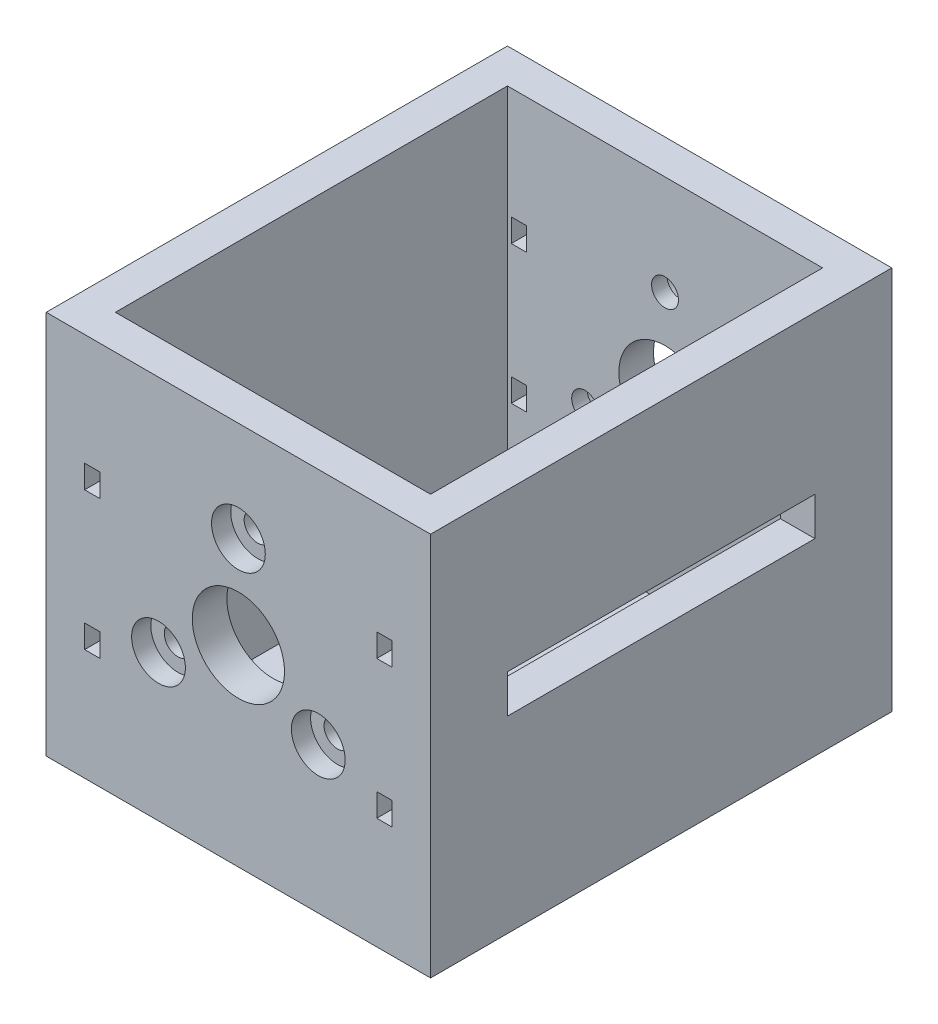
from build123d import *

# Parameters (mm, degrees)
SKETCH1_W                                  = 50
SKETCH1_H                                  = 50
BOSS_EXTRUDE1_DEPTH                        = 30
SKETCH3_R                                  = 6
CUT_EXTRUDE1_DEPTH                         = 70
SKETCH5_W                                  = 41
SKETCH5_H                                  = 51
CUT_EXTRUDE3_DEPTH                         = 48
SKETCH7_R                                  = 1.75
CUT_EXTRUDE5_DEPTH                         = 60
CIRPATTERN3_COUNT                          = 3
SKETCH8_W                                  = 2
SKETCH8_H                                  = 3
CUT_EXTRUDE6_DEPTH                         = 60
MIRROR1_AT_THE_SECOND_PLANE_COPY_1_SKETC_W = 2
MIRROR1_AT_THE_SECOND_PLANE_COPY_1_SKETC_H = 3
MIRROR1_AT_THE_SECOND_PLANE_COPY_1_DEPTH   = 60
SKETCH9_W                                  = 40
SKETCH9_H                                  = 5
CUT_EXTRUDE7_DEPTH                         = 40
SKETCH10_R                                 = 3.5
CUT_EXTRUDE8_DEPTH                         = 2.5
CIRPATTERN4_COUNT                          = 3
MIRROR2_COPY_1_SKETCH_R                    = 3.5
MIRROR2_COPY_1_DEPTH                       = 2.5
MIRROR2_COPY_2_SKETCH_R                    = 3.5
MIRROR2_COPY_2_DEPTH                       = 2.5


with BuildPart() as part:
    # Sketch1 → Boss-Extrude1 (new, symmetric)
    with BuildSketch(Plane.XY):
        Rectangle(SKETCH1_W, SKETCH1_H)
    extrude(amount=BOSS_EXTRUDE1_DEPTH, both=True)

    # Sketch3 → Cut-Extrude1 (cut)
    with BuildSketch(Plane.XY.offset(30)):
        Circle(SKETCH3_R)
    extrude(amount=-CUT_EXTRUDE1_DEPTH, mode=Mode.SUBTRACT)

    # Sketch5 → Cut-Extrude3 (cut)
    with BuildSketch(Plane(origin=(0, 25, 0), x_dir=(1, 0, 0), z_dir=(0, 1, 0))):
        Rectangle(SKETCH5_W, SKETCH5_H)
    extrude(amount=-CUT_EXTRUDE3_DEPTH, mode=Mode.SUBTRACT)

    # Sketch7 → Cut-Extrude5 (cut)
    with BuildSketch(Plane.XY.offset(30)):
        with Locations((0, 12)):
            Circle(SKETCH7_R)
    cut_extrude5 = extrude(amount=-CUT_EXTRUDE5_DEPTH, mode=Mode.SUBTRACT)

    # CirPattern3: Cut-Extrude5 ×3 about axis
    cirpattern3_axis = Axis((0, 0, 0), (0, 0, 1))
    for i in range(1, CIRPATTERN3_COUNT):
        add(cut_extrude5.rotate(cirpattern3_axis, i * 360 / CIRPATTERN3_COUNT), mode=Mode.SUBTRACT)

    # Sketch8 → Cut-Extrude6 (cut)
    with BuildSketch(Plane.XY.offset(30)):
        with Locations((19, 9)):
            Rectangle(SKETCH8_W, SKETCH8_H)
    cut_extrude6 = extrude(amount=-CUT_EXTRUDE6_DEPTH, mode=Mode.SUBTRACT)

    # Mirror1: Cut-Extrude6 across plane
    add(cut_extrude6.mirror(Plane.ZX), mode=Mode.SUBTRACT)

    # Mirror1 at the second plane: Cut-Extrude6 across plane
    add(cut_extrude6.mirror(Plane(origin=(0, 0, 0), x_dir=(0, 0, 1), z_dir=(1, 0, 0))), mode=Mode.SUBTRACT)

    # Mirror1 at the second plane copy 1 sketc → Mirror1 at the second plane copy 1 (cut)
    with BuildSketch(Plane(origin=(0, 0, 30), x_dir=(-1, 0, 0), z_dir=(0, 0, 1))):
        with Locations((19, 9)):
            Rectangle(MIRROR1_AT_THE_SECOND_PLANE_COPY_1_SKETC_W, MIRROR1_AT_THE_SECOND_PLANE_COPY_1_SKETC_H)
    extrude(amount=-MIRROR1_AT_THE_SECOND_PLANE_COPY_1_DEPTH, mode=Mode.SUBTRACT)

    # Sketch9 → Cut-Extrude7 (cut)
    with BuildSketch(Plane(origin=(25, 0, 0), x_dir=(0, 0, -1), z_dir=(1, 0, 0))):
        with Locations((0, 2)):
            Rectangle(SKETCH9_W, SKETCH9_H)
    extrude(amount=-CUT_EXTRUDE7_DEPTH, mode=Mode.SUBTRACT)

    # Sketch10 → Cut-Extrude8 (cut)
    with BuildSketch(Plane.XY.offset(30)):
        with Locations((0, 12)):
            Circle(SKETCH10_R)
    cut_extrude8 = extrude(amount=-CUT_EXTRUDE8_DEPTH, mode=Mode.SUBTRACT)

    # CirPattern4: Cut-Extrude8 ×3 about axis
    cirpattern4_axis = Axis((0, 0, 0), (0, 0, 1))
    for i in range(1, CIRPATTERN4_COUNT):
        add(cut_extrude8.rotate(cirpattern4_axis, i * 360 / CIRPATTERN4_COUNT), mode=Mode.SUBTRACT)

    # Mirror2: Cut-Extrude8 across plane
    add(cut_extrude8.mirror(Plane.XY), mode=Mode.SUBTRACT)

    # Mirror2 copy 1 sketch → Mirror2 copy 1 (cut)
    with BuildSketch(Plane(origin=(0, 0, -30), x_dir=(-0.4999999999999998, 0.8660254037844387, 0), z_dir=(0, 0, -1))):
        with Locations((0, -12)):
            Circle(MIRROR2_COPY_1_SKETCH_R)
    extrude(amount=-MIRROR2_COPY_1_DEPTH, mode=Mode.SUBTRACT)

    # Mirror2 copy 2 sketch → Mirror2 copy 2 (cut)
    with BuildSketch(Plane(origin=(0, 0, -30), x_dir=(-0.5000000000000004, -0.8660254037844384, 0), z_dir=(0, 0, -1))):
        with Locations((0, -12)):
            Circle(MIRROR2_COPY_2_SKETCH_R)
    extrude(amount=-MIRROR2_COPY_2_DEPTH, mode=Mode.SUBTRACT)


solid = part.part
